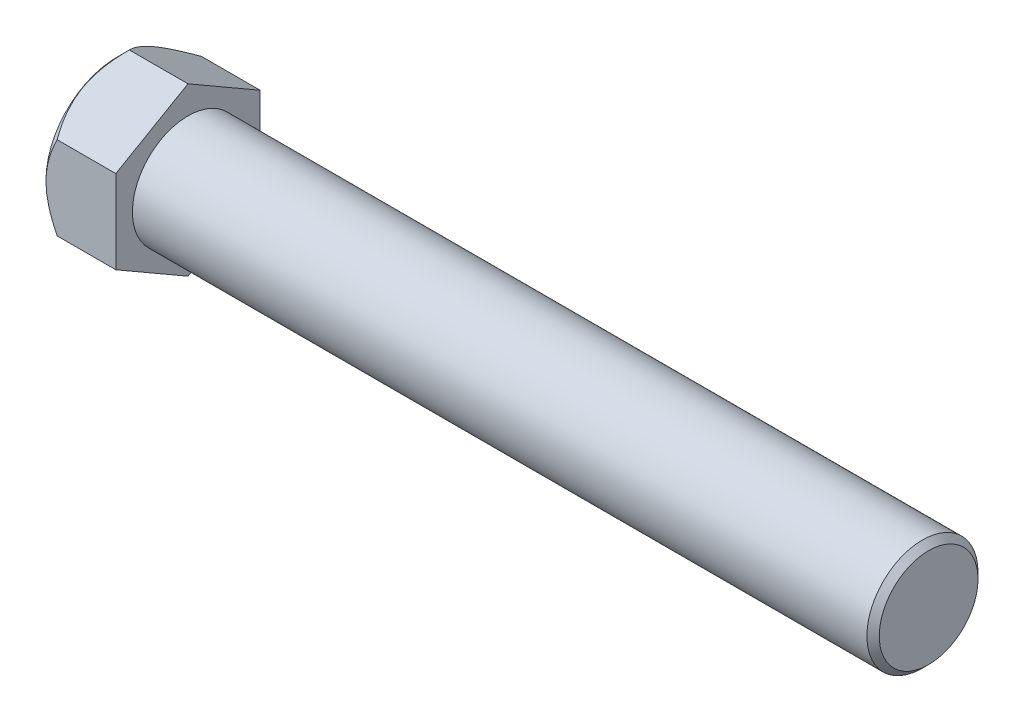
from build123d import *

# Parameters (mm, degrees)
EXTRUDE1_DEPTH     = 11.5
SKETCH3_R          = 9
EXTRUDE2_DEPTH     = 120
CHAMFER1_SIZE      = 1
CUT_EXTRUDE1_DEPTH = 0.01


with BuildPart() as part:
    # Sketch1 → Extrude1 (new body)
    with BuildSketch(Plane(origin=(0, 0, 0), x_dir=(0, 0, -1), z_dir=(1, 0, 0))):
        Polygon((0, 13.5), (-11.691342951, 6.75), (-11.691342951, -6.75), (0, -13.5), (11.691342951, -6.75), (11.691342951, 6.75), align=None)
    extrude(amount=EXTRUDE1_DEPTH)

    # Sketch2 → Cut-Revolve1 (revolve, cut)
    with BuildSketch(Plane.XY, mode=Mode.PRIVATE) as cut_revolve1_sk:
        Polygon((2, 13.5), (0, 11.5), (0, 13.5), align=None)
    revolve(cut_revolve1_sk.sketch.rotate(Axis((0, 0, 0), (1, 0, 0)), 300.000000041), axis=Axis((0, 0, 0), (1, 0, 0)), mode=Mode.SUBTRACT)

    # Sketch3 → Extrude2 (add)
    with BuildSketch(Plane(origin=(11.5, 0, 0), x_dir=(0, 0, -1), z_dir=(1, 0, 0))):
        Circle(SKETCH3_R)
    extrude(amount=EXTRUDE2_DEPTH)

    # Chamfer1
    chamfer1_edges = [part.edges().sort_by_distance(p)[0] for p in [
        (131.5, 0, 9),
    ]]
    chamfer(chamfer1_edges, length=CHAMFER1_SIZE)

    # Sketch4 → Cut-Extrude1 (cut)
    # profile 1 of 3: a face of its own
    with BuildSketch(Plane.ZY):
        with BuildLine():
            add(Edge.make_bspline(
                [(-1.076221955, -1.772098926), (-1.055758707, -1.782768894), (-1.01584854, -1.803578896), (-0.959007677, -1.83708663), (-0.907061247, -1.872401605), (-0.858567989, -1.907855791), (-0.814379881, -1.94480697), (-0.774991015, -1.983402082), (-0.739428429, -2.022677757), (-0.708409298, -2.063299071), (-0.681125843, -2.105158106), (-0.657545746, -2.14836473), (-0.637390601, -2.192824254), (-0.621417074, -2.23902199), (-0.608258651, -2.286279319), (-0.599204647, -2.335206449), (-0.59433542, -2.385480979), (-0.593414839, -2.419458337), (-0.592948718, -2.436662227)],
                knots=[0, 0, 0, 0, 1.272397273, 2.481599622, 3.635517121, 4.734568067, 5.792894095, 6.808321871, 7.773003508, 8.711915296, 9.623354172, 10.525449501, 11.423591555, 12.311487226, 13.218079475, 14.126165749, 15.051214107, 16, 16, 16, 16], degree=3))
            add(Edge.make_bspline(
                [(-0.592948718, -2.436662227), (-0.593499733, -2.460732036), (-0.594590397, -2.508375219), (-0.604090386, -2.57869387), (-0.618313942, -2.646988), (-0.639085022, -2.713242637), (-0.666023159, -2.777092189), (-0.699220899, -2.838591313), (-0.736800331, -2.898747962), (-0.766980502, -2.935761821), (-0.782251603, -2.954490753)],
                knots=[0, 0, 0, 0, 1.025265484, 2.029385089, 3.018602448, 3.995076438, 4.983346944, 5.966715145, 6.97116228, 8, 8, 8, 8], degree=3))
            add(Edge.make_bspline(
                [(-0.782251603, -2.954490753), (-0.802134798, -2.976343448), (-0.841655488, -3.0197788), (-0.909357579, -3.076172236), (-0.983658925, -3.12356466), (-1.06427202, -3.162187442), (-1.150981378, -3.19224877), (-1.243768524, -3.213850568), (-1.342814347, -3.226223732), (-1.410889684, -3.228012296), (-1.445813301, -3.228929855)],
                knots=[0, 0, 0, 0, 0.954267603, 1.896743057, 2.838368354, 3.796610408, 4.779680527, 5.799409237, 6.871065594, 8, 8, 8, 8], degree=3))
            add(Edge.make_bspline(
                [(-1.445813301, -3.228929855), (-1.479394293, -3.228106657), (-1.544739492, -3.226504796), (-1.639852262, -3.21565163), (-1.728511598, -3.196631726), (-1.811233004, -3.170599862), (-1.887517785, -3.136735413), (-1.957148571, -3.09458655), (-2.02112998, -3.045849805), (-2.077520318, -2.989125464), (-2.127583492, -2.928369841), (-2.171560673, -2.865690119), (-2.208113586, -2.801080578), (-2.239061512, -2.735504602), (-2.262752956, -2.668043063), (-2.279161678, -2.599043054), (-2.289582617, -2.528625094), (-2.290969142, -2.481102485), (-2.291666667, -2.457195079)],
                knots=[0, 0, 0, 0, 1.256902934, 2.445805442, 3.576955095, 4.645999104, 5.686449165, 6.692658513, 7.68621702, 8.689161843, 9.678783111, 10.630372946, 11.551080876, 12.453998257, 13.34127905, 14.221779781, 15.105423033, 16, 16, 16, 16], degree=3))
            add(Edge.make_bspline(
                [(-2.291666667, -2.457195079), (-2.291253895, -2.439652799), (-2.290438111, -2.404983062), (-2.284791791, -2.353762114), (-2.275714318, -2.303907732), (-2.263386135, -2.255235772), (-2.246678259, -2.208100577), (-2.226505307, -2.16227881), (-2.202982484, -2.11771874), (-2.175781651, -2.074176682), (-2.144137349, -2.032262744), (-2.10830617, -1.991265605), (-2.067571978, -1.951821415), (-2.022387936, -1.913448254), (-1.973270408, -1.875465416), (-1.9189436, -1.839925609), (-1.860847695, -1.804312777), (-1.819558119, -1.783021116), (-1.798377404, -1.772098926)],
                knots=[0, 0, 0, 0, 0.941657376, 1.861047343, 2.762797495, 3.66048619, 4.553285746, 5.444104102, 6.34607688, 7.256116206, 8.197091036, 9.162375105, 10.176350973, 11.237807142, 12.343728897, 13.50695164, 14.721116704, 16, 16, 16, 16], degree=3))
            add(Edge.make_bspline(
                [(-1.798377404, -1.772098926), (-1.827371243, -1.756288377), (-1.883511431, -1.725674728), (-1.957846746, -1.66942701), (-2.021697191, -1.608507142), (-2.073307704, -1.541628717), (-2.113930724, -1.47088095), (-2.141801156, -1.396706484), (-2.160655787, -1.320480688), (-2.162523521, -1.268404834), (-2.163461538, -1.242251169)],
                knots=[0, 0, 0, 0, 1.166880483, 2.259407225, 3.286803203, 4.280235371, 5.237608625, 6.161067461, 7.076446754, 8, 8, 8, 8], degree=3))
            add(Edge.make_bspline(
                [(-2.163461538, -1.242251169), (-2.162293378, -1.215610056), (-2.159945173, -1.162056773), (-2.140957087, -1.082338113), (-2.110014182, -1.004040567), (-2.067927756, -0.927543629), (-2.015508316, -0.855436333), (-1.952617926, -0.790764228), (-1.880758428, -0.734113169), (-1.800288523, -0.68655876), (-1.713691212, -0.647856147), (-1.622322838, -0.621157273), (-1.527775342, -0.603702904), (-1.463419829, -0.601726722), (-1.430789263, -0.600724727)],
                knots=[0, 0, 0, 0, 0.888701115, 1.786444228, 2.72001202, 3.692817113, 4.693886446, 5.687152267, 6.695133018, 7.739871481, 8.800368666, 9.853104506, 10.91144658, 12, 12, 12, 12], degree=3))
            add(Edge.make_bspline(
                [(-1.430789263, -0.600724727), (-1.399000824, -0.601757829), (-1.336317643, -0.603794989), (-1.244178623, -0.620785616), (-1.156017996, -0.649163845), (-1.072139783, -0.687661861), (-0.994045592, -0.735081105), (-0.925043942, -0.7925103), (-0.864092098, -0.856897122), (-0.813674674, -0.928982553), (-0.772129752, -1.005185549), (-0.743200537, -1.084915921), (-0.724663413, -1.166450963), (-0.722325296, -1.221620966), (-0.721153846, -1.249262387)],
                knots=[0, 0, 0, 0, 1.072916533, 2.115669174, 3.151510826, 4.193348718, 5.225979165, 6.227137561, 7.216255879, 8.211077061, 9.189680878, 10.138522389, 11.067357538, 12, 12, 12, 12], degree=3))
            add(Edge.make_bspline(
                [(-0.721153846, -1.249262387), (-0.722178532, -1.276388576), (-0.724190958, -1.329662868), (-0.741119486, -1.407324668), (-0.769628996, -1.480054696), (-0.808553398, -1.548678233), (-0.859285889, -1.611950732), (-0.92114927, -1.670676782), (-0.993650325, -1.725338802), (-1.048122387, -1.756186205), (-1.076221955, -1.772098926)],
                knots=[0, 0, 0, 0, 0.975232327, 1.915300861, 2.843280834, 3.77672583, 4.742871857, 5.749627742, 6.839139064, 8, 8, 8, 8], degree=3))
        make_face()
        with BuildLine():
            add(Edge.make_bspline(
                [(-1.443309295, -0.857134983), (-1.460845585, -0.857600298), (-1.495154236, -0.858510657), (-1.545460429, -0.863266826), (-1.593297834, -0.872519124), (-1.639166264, -0.884832489), (-1.682436844, -0.901466767), (-1.72369724, -0.92103463), (-1.762245233, -0.944824677), (-1.798546163, -0.971511247), (-1.831225288, -1.000863323), (-1.860228539, -1.031444551), (-1.884320049, -1.063855545), (-1.904777985, -1.097290088), (-1.919621926, -1.132740499), (-1.930739285, -1.169119911), (-1.938254565, -1.206888042), (-1.938817701, -1.232699836), (-1.939102564, -1.245756778)],
                knots=[0, 0, 0, 0, 1.203892937, 2.355340988, 3.463153438, 4.544400666, 5.610487187, 6.640501085, 7.674077295, 8.714426146, 9.728707835, 10.68524104, 11.601827946, 12.495867327, 13.368432065, 14.231010473, 15.105153427, 16, 16, 16, 16], degree=3))
            add(Edge.make_bspline(
                [(-1.939102564, -1.245756778), (-1.938611588, -1.258814285), (-1.937641348, -1.284617794), (-1.930137685, -1.322721984), (-1.918954217, -1.36016601), (-1.901346602, -1.396059518), (-1.880227775, -1.431647632), (-1.854162435, -1.466040908), (-1.823098843, -1.49935904), (-1.788079243, -1.531318641), (-1.749928145, -1.561246329), (-1.709510971, -1.587227173), (-1.667334977, -1.608965823), (-1.623833499, -1.627058255), (-1.578563179, -1.641122496), (-1.531801413, -1.6511001), (-1.48354034, -1.657301527), (-1.450839925, -1.658042256), (-1.434294872, -1.658417035)],
                knots=[0, 0, 0, 0, 0.873023192, 1.725219244, 2.590779336, 3.480155217, 4.391973325, 5.357036234, 6.360879153, 7.436073238, 8.526419356, 9.601555421, 10.645666583, 11.697338044, 12.750135903, 13.812665442, 14.89329948, 16, 16, 16, 16], degree=3))
            add(Edge.make_bspline(
                [(-1.434294872, -1.658417035), (-1.413044798, -1.657793558), (-1.370754535, -1.656552763), (-1.308412155, -1.64501621), (-1.247795981, -1.626869126), (-1.189553906, -1.602040579), (-1.135193488, -1.570877822), (-1.086736297, -1.533568523), (-1.044595659, -1.490974168), (-1.009209509, -1.443757857), (-0.981773904, -1.393506722), (-0.96041547, -1.343077942), (-0.947943173, -1.291933491), (-0.94631634, -1.257671374), (-0.945512821, -1.240748765)],
                knots=[0, 0, 0, 0, 1.076279235, 2.141928126, 3.20205304, 4.278698113, 5.344010996, 6.36967002, 7.368914609, 8.37248503, 9.349703398, 10.264243087, 11.142681841, 12, 12, 12, 12], degree=3))
            add(Edge.make_bspline(
                [(-0.945512821, -1.240748765), (-0.945892747, -1.228871597), (-0.946646848, -1.20529712), (-0.952861173, -1.170484002), (-0.963129626, -1.136462871), (-0.977031826, -1.102952677), (-0.995324536, -1.070423583), (-1.017013241, -1.038364234), (-1.043359314, -1.007495832), (-1.072928195, -0.977099011), (-1.10646063, -0.948967566), (-1.143891996, -0.924228487), (-1.185030389, -0.903219661), (-1.229876782, -0.886156265), (-1.278266013, -0.873340301), (-1.329975209, -0.863742909), (-1.385435528, -0.858333544), (-1.423599636, -0.857543169), (-1.443309295, -0.857134983)],
                knots=[0, 0, 0, 0, 0.814439003, 1.616544685, 2.417341072, 3.248991801, 4.09997495, 4.973547432, 5.9003056, 6.880240646, 7.880314356, 8.896779544, 9.951930927, 11.043077905, 12.18215768, 13.381699519, 14.647792085, 16, 16, 16, 16], degree=3))
        make_face(mode=Mode.SUBTRACT)
        with BuildLine():
            add(Edge.make_bspline(
                [(-1.428786058, -1.914827291), (-1.451018762, -1.915222749), (-1.494633902, -1.915998541), (-1.558531708, -1.924633899), (-1.619855397, -1.936654894), (-1.678398209, -1.954891207), (-1.734135421, -1.978602986), (-1.787368766, -2.007127657), (-1.837691001, -2.040845831), (-1.884407234, -2.079329128), (-1.927066755, -2.120800166), (-1.964494113, -2.164701691), (-1.996278056, -2.210217786), (-2.021873235, -2.257926522), (-2.042881615, -2.306817672), (-2.056677242, -2.358108812), (-2.065521321, -2.410813892), (-2.066708915, -2.446642534), (-2.067307692, -2.464707099)],
                knots=[0, 0, 0, 0, 1.140299081, 2.23698856, 3.303958914, 4.344563908, 5.37730929, 6.408454204, 7.439741482, 8.480804886, 9.510774543, 10.48932336, 11.43758569, 12.353841022, 13.263987381, 14.161954604, 15.073269652, 16, 16, 16, 16], degree=3))
            add(Edge.make_bspline(
                [(-2.067307692, -2.464707099), (-2.066333936, -2.487157746), (-2.064402026, -2.531699305), (-2.049075856, -2.597530071), (-2.024479045, -2.661259396), (-1.990175319, -2.722367933), (-1.947698481, -2.779475152), (-1.89546529, -2.829252849), (-1.836721835, -2.873482476), (-1.76948051, -2.909254286), (-1.696031606, -2.93782204), (-1.616394657, -2.95750487), (-1.531712572, -2.970534477), (-1.473241435, -2.971847464), (-1.443309295, -2.972519599)],
                knots=[0, 0, 0, 0, 0.898778495, 1.783155532, 2.693654817, 3.627872908, 4.583023416, 5.533784346, 6.509005473, 7.520592997, 8.575161974, 9.658835044, 10.801527049, 12, 12, 12, 12], degree=3))
            add(Edge.make_bspline(
                [(-1.443309295, -2.972519599), (-1.419916175, -2.97207045), (-1.374338876, -2.971195364), (-1.307848912, -2.963470868), (-1.245102806, -2.951221136), (-1.186222236, -2.933404318), (-1.130548064, -2.911654334), (-1.07902424, -2.883674276), (-1.030325292, -2.851851188), (-0.986850919, -2.814095362), (-0.94725577, -2.773752866), (-0.912731989, -2.731045692), (-0.88276231, -2.687134526), (-0.859240199, -2.641027037), (-0.840435732, -2.593607812), (-0.826918907, -2.54443959), (-0.818578753, -2.493371567), (-0.817735256, -2.458729373), (-0.817307692, -2.441169438)],
                knots=[0, 0, 0, 0, 1.224942928, 2.386581632, 3.501229538, 4.569074225, 5.605009692, 6.626002462, 7.634866581, 8.645888296, 9.63523824, 10.59253846, 11.518950513, 12.414518923, 13.29783783, 14.186679152, 15.080837789, 16, 16, 16, 16], degree=3))
            add(Edge.make_bspline(
                [(-0.817307692, -2.441169438), (-0.817954727, -2.424114195), (-0.819230566, -2.390484235), (-0.827328203, -2.340651001), (-0.84155383, -2.292506134), (-0.861073399, -2.245470416), (-0.887059801, -2.200496879), (-0.917663279, -2.1564139), (-0.95458765, -2.114445011), (-0.996310933, -2.074264228), (-1.041781619, -2.03711013), (-1.090115294, -2.004242674), (-1.140939909, -1.976562591), (-1.194147917, -1.954050809), (-1.249621172, -1.936345473), (-1.30731887, -1.923976905), (-1.367308567, -1.916191475), (-1.408062046, -1.915287156), (-1.428786058, -1.914827291)],
                knots=[0, 0, 0, 0, 0.917430815, 1.809013306, 2.70690318, 3.612392954, 4.541220862, 5.495268465, 6.494511384, 7.542276156, 8.608045339, 9.649016899, 10.681629292, 11.715607085, 12.752076957, 13.808767841, 14.885711793, 16, 16, 16, 16], degree=3))
        make_face(mode=Mode.SUBTRACT)
    # profile 2 of 3: a face of its own
    with BuildSketch(Plane.ZY):
        with BuildLine():
            add(Edge.make_bspline(
                [(0.032051282, -2.780211906), (0.045972862, -2.781039168), (0.073264492, -2.782660919), (0.112721013, -2.793787114), (0.148431484, -2.8135433), (0.18024023, -2.839873856), (0.206459142, -2.87179933), (0.226919394, -2.907224979), (0.237948669, -2.947011831), (0.239558606, -2.974461599), (0.240384615, -2.98854524)],
                knots=[0, 0, 0, 0, 1.020151414, 1.999887582, 2.974338812, 3.990962822, 5.007586832, 5.987933904, 6.967670073, 8, 8, 8, 8], degree=3))
            add(Edge.make_bspline(
                [(0.240384615, -2.98854524), (0.239530615, -3.002290475), (0.237846538, -3.029395878), (0.226944675, -3.068882637), (0.206303211, -3.104330426), (0.180421073, -3.136689096), (0.148423621, -3.163075432), (0.112636587, -3.182663535), (0.073357117, -3.194586378), (0.045988315, -3.196105162), (0.032051282, -3.196878573)],
                knots=[0, 0, 0, 0, 1.009421747, 1.99056486, 2.972319754, 3.999869655, 5.017953583, 5.993804169, 6.978383603, 8, 8, 8, 8], degree=3))
            add(Edge.make_bspline(
                [(0.032051282, -3.196878573), (0.018104207, -3.196133147), (-0.009124138, -3.194677879), (-0.048256991, -3.182418731), (-0.084261969, -3.163259117), (-0.116253191, -3.136639896), (-0.1423521, -3.104496936), (-0.162084516, -3.06863851), (-0.173934622, -3.029508912), (-0.175493103, -3.002312739), (-0.176282051, -2.98854524)],
                knots=[0, 0, 0, 0, 1.022052826, 1.995314843, 2.982371812, 4.00089066, 5.028879526, 6.005146991, 6.990147033, 8, 8, 8, 8], degree=3))
            add(Edge.make_bspline(
                [(-0.176282051, -2.98854524), (-0.175523409, -2.97443854), (-0.174042253, -2.94689694), (-0.162059638, -2.907469006), (-0.142505201, -2.871634407), (-0.116072776, -2.839922564), (-0.084269708, -2.813360205), (-0.048343847, -2.79402821), (-0.00902989, -2.782570772), (0.018120066, -2.781011832), (0.032051282, -2.780211906)],
                knots=[0, 0, 0, 0, 1.032775665, 2.016367738, 2.991239715, 4.008302682, 5.025365648, 6.011011707, 6.979408107, 8, 8, 8, 8], degree=3))
        make_face()
    # profile 3 of 3: a face of its own
    with BuildSketch(Plane.ZY):
        with BuildLine():
            add(Edge.make_bspline(
                [(1.776342147, -1.772098926), (1.796805395, -1.782768894), (1.836715563, -1.803578896), (1.893556426, -1.83708663), (1.945502855, -1.872401605), (1.993996114, -1.907855791), (2.038184222, -1.94480697), (2.077573088, -1.983402082), (2.113135674, -2.022677757), (2.144154805, -2.063299071), (2.17143826, -2.105158106), (2.195018356, -2.14836473), (2.215173501, -2.192824254), (2.231147029, -2.23902199), (2.244305452, -2.286279319), (2.253359455, -2.335206449), (2.258228682, -2.385480979), (2.259149263, -2.419458337), (2.259615385, -2.436662227)],
                knots=[0, 0, 0, 0, 1.272397273, 2.481599622, 3.635517121, 4.734568067, 5.792894095, 6.808321871, 7.773003508, 8.711915296, 9.623354172, 10.525449501, 11.423591555, 12.311487226, 13.218079475, 14.126165749, 15.051214107, 16, 16, 16, 16], degree=3))
            add(Edge.make_bspline(
                [(2.259615385, -2.436662227), (2.25906437, -2.460732036), (2.257973705, -2.508375219), (2.248473717, -2.57869387), (2.234250161, -2.646988), (2.21347908, -2.713242637), (2.186540944, -2.777092189), (2.153343204, -2.838591313), (2.115763772, -2.898747962), (2.085583601, -2.935761821), (2.0703125, -2.954490753)],
                knots=[0, 0, 0, 0, 1.025265484, 2.029385089, 3.018602448, 3.995076438, 4.983346944, 5.966715145, 6.97116228, 8, 8, 8, 8], degree=3))
            add(Edge.make_bspline(
                [(2.0703125, -2.954490753), (2.050429304, -2.976343448), (2.010908614, -3.0197788), (1.943206523, -3.076172236), (1.868905178, -3.12356466), (1.788292083, -3.162187442), (1.701582725, -3.19224877), (1.608795579, -3.213850568), (1.509749755, -3.226223732), (1.441674419, -3.228012296), (1.406750801, -3.228929855)],
                knots=[0, 0, 0, 0, 0.954267603, 1.896743057, 2.838368354, 3.796610408, 4.779680527, 5.799409237, 6.871065594, 8, 8, 8, 8], degree=3))
            add(Edge.make_bspline(
                [(1.406750801, -3.228929855), (1.373169809, -3.228106657), (1.30782461, -3.226504796), (1.21271184, -3.21565163), (1.124052505, -3.196631726), (1.041331099, -3.170599862), (0.965046318, -3.136735413), (0.895415531, -3.09458655), (0.831434123, -3.045849805), (0.775043784, -2.989125464), (0.72498061, -2.928369841), (0.681003429, -2.865690119), (0.644450516, -2.801080578), (0.613502591, -2.735504602), (0.589811146, -2.668043063), (0.573402425, -2.599043054), (0.562981486, -2.528625094), (0.561594961, -2.481102485), (0.560897436, -2.457195079)],
                knots=[0, 0, 0, 0, 1.256902934, 2.445805442, 3.576955095, 4.645999104, 5.686449165, 6.692658513, 7.68621702, 8.689161843, 9.678783111, 10.630372946, 11.551080876, 12.453998257, 13.34127905, 14.221779781, 15.105423033, 16, 16, 16, 16], degree=3))
            add(Edge.make_bspline(
                [(0.560897436, -2.457195079), (0.561310208, -2.439652799), (0.562125992, -2.404983062), (0.567772312, -2.353762114), (0.576849784, -2.303907732), (0.589177967, -2.255235772), (0.605885844, -2.208100577), (0.626058796, -2.16227881), (0.649581619, -2.11771874), (0.676782451, -2.074176682), (0.708426754, -2.032262744), (0.744257932, -1.991265605), (0.784992124, -1.951821415), (0.830176166, -1.913448254), (0.879293695, -1.875465416), (0.933620502, -1.839925609), (0.991716408, -1.804312777), (1.033005983, -1.783021116), (1.054186699, -1.772098926)],
                knots=[0, 0, 0, 0, 0.941657376, 1.861047343, 2.762797495, 3.66048619, 4.553285746, 5.444104102, 6.34607688, 7.256116206, 8.197091036, 9.162375105, 10.176350973, 11.237807142, 12.343728897, 13.50695164, 14.721116704, 16, 16, 16, 16], degree=3))
            add(Edge.make_bspline(
                [(1.054186699, -1.772098926), (1.02519286, -1.756288377), (0.969052672, -1.725674728), (0.894717357, -1.66942701), (0.830866911, -1.608507142), (0.779256399, -1.541628717), (0.738633379, -1.47088095), (0.710762947, -1.396706484), (0.691908316, -1.320480688), (0.690040582, -1.268404834), (0.689102564, -1.242251169)],
                knots=[0, 0, 0, 0, 1.166880483, 2.259407225, 3.286803203, 4.280235371, 5.237608625, 6.161067461, 7.076446754, 8, 8, 8, 8], degree=3))
            add(Edge.make_bspline(
                [(0.689102564, -1.242251169), (0.690270724, -1.215610056), (0.69261893, -1.162056773), (0.711607016, -1.082338113), (0.74254992, -1.004040567), (0.784636347, -0.927543629), (0.837055787, -0.855436333), (0.899946177, -0.790764228), (0.971805675, -0.734113169), (1.05227558, -0.68655876), (1.138872891, -0.647856147), (1.230241265, -0.621157273), (1.32478876, -0.603702904), (1.389144274, -0.601726722), (1.42177484, -0.600724727)],
                knots=[0, 0, 0, 0, 0.888701115, 1.786444228, 2.72001202, 3.692817113, 4.693886446, 5.687152267, 6.695133018, 7.739871481, 8.800368666, 9.853104506, 10.91144658, 12, 12, 12, 12], degree=3))
            add(Edge.make_bspline(
                [(1.42177484, -0.600724727), (1.453563279, -0.601757829), (1.51624646, -0.603794989), (1.60838548, -0.620785616), (1.696546106, -0.649163845), (1.78042432, -0.687661861), (1.858518511, -0.735081105), (1.92752016, -0.7925103), (1.988472005, -0.856897122), (2.038889429, -0.928982553), (2.08043435, -1.005185549), (2.109363565, -1.084915921), (2.127900689, -1.166450963), (2.130238807, -1.221620966), (2.131410256, -1.249262387)],
                knots=[0, 0, 0, 0, 1.072916533, 2.115669174, 3.151510826, 4.193348718, 5.225979165, 6.227137561, 7.216255879, 8.211077061, 9.189680878, 10.138522389, 11.067357538, 12, 12, 12, 12], degree=3))
            add(Edge.make_bspline(
                [(2.131410256, -1.249262387), (2.13038557, -1.276388576), (2.128373145, -1.329662868), (2.111444617, -1.407324668), (2.082935107, -1.480054696), (2.044010705, -1.548678233), (1.993278214, -1.611950732), (1.931414833, -1.670676782), (1.858913777, -1.725338802), (1.804441715, -1.756186205), (1.776342147, -1.772098926)],
                knots=[0, 0, 0, 0, 0.975232327, 1.915300861, 2.843280834, 3.77672583, 4.742871857, 5.749627742, 6.839139064, 8, 8, 8, 8], degree=3))
        make_face()
        with BuildLine():
            add(Edge.make_bspline(
                [(1.409254808, -0.857134983), (1.391718518, -0.857600298), (1.357409867, -0.858510657), (1.307103673, -0.863266826), (1.259266268, -0.872519124), (1.213397839, -0.884832489), (1.170127259, -0.901466767), (1.128866863, -0.92103463), (1.09031887, -0.944824677), (1.054017939, -0.971511247), (1.021338815, -1.000863323), (0.992335564, -1.031444551), (0.968244053, -1.063855545), (0.947786118, -1.097290088), (0.932942177, -1.132740499), (0.921824817, -1.169119911), (0.914309537, -1.206888042), (0.913746402, -1.232699836), (0.913461538, -1.245756778)],
                knots=[0, 0, 0, 0, 1.203892937, 2.355340988, 3.463153438, 4.544400666, 5.610487187, 6.640501085, 7.674077295, 8.714426146, 9.728707835, 10.68524104, 11.601827946, 12.495867327, 13.368432065, 14.231010473, 15.105153427, 16, 16, 16, 16], degree=3))
            add(Edge.make_bspline(
                [(0.913461538, -1.245756778), (0.913952515, -1.258814285), (0.914922755, -1.284617794), (0.922426418, -1.322721984), (0.933609885, -1.36016601), (0.951217501, -1.396059518), (0.972336328, -1.431647632), (0.998401668, -1.466040908), (1.029465259, -1.49935904), (1.06448486, -1.531318641), (1.102635958, -1.561246329), (1.143053132, -1.587227173), (1.185229126, -1.608965823), (1.228730604, -1.627058255), (1.274000923, -1.641122496), (1.32076269, -1.6511001), (1.369023763, -1.657301527), (1.401724178, -1.658042256), (1.418269231, -1.658417035)],
                knots=[0, 0, 0, 0, 0.873023192, 1.725219244, 2.590779336, 3.480155217, 4.391973325, 5.357036234, 6.360879153, 7.436073238, 8.526419356, 9.601555421, 10.645666583, 11.697338044, 12.750135903, 13.812665442, 14.89329948, 16, 16, 16, 16], degree=3))
            add(Edge.make_bspline(
                [(1.418269231, -1.658417035), (1.439519305, -1.657793558), (1.481809568, -1.656552763), (1.544151947, -1.64501621), (1.604768122, -1.626869126), (1.663010196, -1.602040579), (1.717370614, -1.570877822), (1.765827806, -1.533568523), (1.807968444, -1.490974168), (1.843354594, -1.443757857), (1.870790198, -1.393506722), (1.892148633, -1.343077942), (1.904620929, -1.291933491), (1.906247763, -1.257671374), (1.907051282, -1.240748765)],
                knots=[0, 0, 0, 0, 1.076279235, 2.141928126, 3.20205304, 4.278698113, 5.344010996, 6.36967002, 7.368914609, 8.37248503, 9.349703398, 10.264243087, 11.142681841, 12, 12, 12, 12], degree=3))
            add(Edge.make_bspline(
                [(1.907051282, -1.240748765), (1.906671355, -1.228871597), (1.905917255, -1.20529712), (1.899702929, -1.170484002), (1.889434477, -1.136462871), (1.875532277, -1.102952677), (1.857239566, -1.070423583), (1.835550861, -1.038364234), (1.809204789, -1.007495832), (1.779635908, -0.977099011), (1.746103473, -0.948967566), (1.708672107, -0.924228487), (1.667533714, -0.903219661), (1.622687321, -0.886156265), (1.57429809, -0.873340301), (1.522588894, -0.863742909), (1.467128574, -0.858333544), (1.428964466, -0.857543169), (1.409254808, -0.857134983)],
                knots=[0, 0, 0, 0, 0.814439003, 1.616544685, 2.417341072, 3.248991801, 4.09997495, 4.973547432, 5.9003056, 6.880240646, 7.880314356, 8.896779544, 9.951930927, 11.043077905, 12.18215768, 13.381699519, 14.647792085, 16, 16, 16, 16], degree=3))
        make_face(mode=Mode.SUBTRACT)
        with BuildLine():
            add(Edge.make_bspline(
                [(1.423778045, -1.914827291), (1.401545341, -1.915222749), (1.357930201, -1.915998541), (1.294032395, -1.924633899), (1.232708705, -1.936654894), (1.174165893, -1.954891207), (1.118428681, -1.978602986), (1.065195337, -2.007127657), (1.014873101, -2.040845831), (0.968156868, -2.079329128), (0.925497347, -2.120800166), (0.88806999, -2.164701691), (0.856286047, -2.210217786), (0.830690868, -2.257926522), (0.809682488, -2.306817672), (0.795886861, -2.358108812), (0.787042781, -2.410813892), (0.785855187, -2.446642534), (0.78525641, -2.464707099)],
                knots=[0, 0, 0, 0, 1.140299081, 2.23698856, 3.303958914, 4.344563908, 5.37730929, 6.408454204, 7.439741482, 8.480804886, 9.510774543, 10.48932336, 11.43758569, 12.353841022, 13.263987381, 14.161954604, 15.073269652, 16, 16, 16, 16], degree=3))
            add(Edge.make_bspline(
                [(0.78525641, -2.464707099), (0.786230167, -2.487157746), (0.788162076, -2.531699305), (0.803488247, -2.597530071), (0.828085058, -2.661259396), (0.862388784, -2.722367933), (0.904865621, -2.779475152), (0.957098812, -2.829252849), (1.015842268, -2.873482476), (1.083083592, -2.909254286), (1.156532497, -2.93782204), (1.236169446, -2.95750487), (1.320851531, -2.970534477), (1.379322668, -2.971847464), (1.409254808, -2.972519599)],
                knots=[0, 0, 0, 0, 0.898778495, 1.783155532, 2.693654817, 3.627872908, 4.583023416, 5.533784346, 6.509005473, 7.520592997, 8.575161974, 9.658835044, 10.801527049, 12, 12, 12, 12], degree=3))
            add(Edge.make_bspline(
                [(1.409254808, -2.972519599), (1.432647928, -2.97207045), (1.478225227, -2.971195364), (1.54471519, -2.963470868), (1.607461297, -2.951221136), (1.666341867, -2.933404318), (1.722016038, -2.911654334), (1.773539862, -2.883674276), (1.82223881, -2.851851188), (1.865713184, -2.814095362), (1.905308333, -2.773752866), (1.939832113, -2.731045692), (1.969801793, -2.687134526), (1.993323904, -2.641027037), (2.012128371, -2.593607812), (2.025645196, -2.54443959), (2.033985349, -2.493371567), (2.034828846, -2.458729373), (2.03525641, -2.441169438)],
                knots=[0, 0, 0, 0, 1.224942928, 2.386581632, 3.501229538, 4.569074225, 5.605009692, 6.626002462, 7.634866581, 8.645888296, 9.63523824, 10.59253846, 11.518950513, 12.414518923, 13.29783783, 14.186679152, 15.080837789, 16, 16, 16, 16], degree=3))
            add(Edge.make_bspline(
                [(2.03525641, -2.441169438), (2.034609376, -2.424114195), (2.033333536, -2.390484235), (2.0252359, -2.340651001), (2.011010273, -2.292506134), (1.991490704, -2.245470416), (1.965504302, -2.200496879), (1.934900823, -2.1564139), (1.897976453, -2.114445011), (1.85625317, -2.074264228), (1.810782484, -2.03711013), (1.762448809, -2.004242674), (1.711624193, -1.976562591), (1.658416185, -1.954050809), (1.602942931, -1.936345473), (1.545245232, -1.923976905), (1.485255536, -1.916191475), (1.444502057, -1.915287156), (1.423778045, -1.914827291)],
                knots=[0, 0, 0, 0, 0.917430815, 1.809013306, 2.70690318, 3.612392954, 4.541220862, 5.495268465, 6.494511384, 7.542276156, 8.608045339, 9.649016899, 10.681629292, 11.715607085, 12.752076957, 13.808767841, 14.885711793, 16, 16, 16, 16], degree=3))
        make_face(mode=Mode.SUBTRACT)
    extrude(amount=-CUT_EXTRUDE1_DEPTH, mode=Mode.SUBTRACT)


solid = part.part
